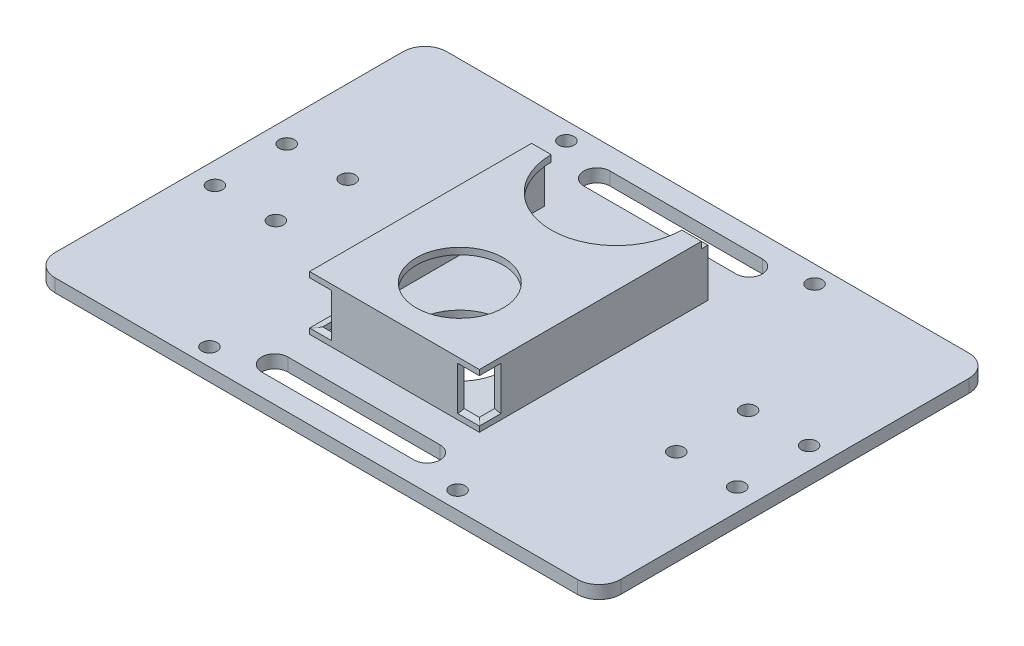
from build123d import *

# Parameters (mm, degrees)
SKETCH_1_R          = 1.75
EXTRUDE_1_DEPTH     = 3
EXTRUDE_2_DEPTH     = 11
EXTRUDE_3_DEPTH     = 1.5
SKETCH_5_R          = 10
CUT_EXTRUDE_1_DEPTH = 81.562087858
SKETCH_6_R          = 5
CUT_EXTRUDE_2_DEPTH = 5
SKETCH_7_R          = 5
CUT_EXTRUDE_3_DEPTH = 5
CUT_EXTRUDE_4_DEPTH = 3


with BuildPart() as part:
    # 草图1 → 凸台-拉伸1 (new body)
    with BuildSketch(Plane(origin=(0, 0, 0), x_dir=(1, 0, 0), z_dir=(0, 1, 0))):
        with BuildLine():
            Line((-60, 45), (60, 45))
            ThreePointArc((60, 45), (63.535533906, 43.535533906), (65, 40))
            Line((65, 40), (65, -40))
            ThreePointArc((65, -40), (63.535533906, -43.535533906), (60, -45))
            Line((60, -45), (-60, -45))
            ThreePointArc((-60, -45), (-63.535533906, -43.535533906), (-65, -40))
            Line((-65, -40), (-65, 40))
            ThreePointArc((-65, 40), (-63.535533906, 43.535533906), (-60, 45))
        make_face()
        with Locations(Location((-60, 8.25, 0), (0, 0, 270))):
            Circle(SKETCH_1_R, mode=Mode.SUBTRACT)
        with Locations(Location((-46, 8.25, 0), (0, 0, 270))):
            Circle(SKETCH_1_R, mode=Mode.SUBTRACT)
        with Locations(Location((-46, -8.25, 0), (0, 0, 90))):
            Circle(SKETCH_1_R, mode=Mode.SUBTRACT)
        with Locations(Location((-60, -8.25, 0), (0, 0, 90))):
            Circle(SKETCH_1_R, mode=Mode.SUBTRACT)
        with Locations(Location((60, 8.25, 0), (0, 0, 90))):
            Circle(SKETCH_1_R, mode=Mode.SUBTRACT)
        with Locations(Location((60, -8.25, 0), (0, 0, 270))):
            Circle(SKETCH_1_R, mode=Mode.SUBTRACT)
        with Locations(Location((46, -8.25, 0), (0, 0, 270))):
            Circle(SKETCH_1_R, mode=Mode.SUBTRACT)
        with Locations(Location((46, 8.25, 0), (0, 0, 90))):
            Circle(SKETCH_1_R, mode=Mode.SUBTRACT)
        with Locations(Location((-28.5, 41, 0), (0, 0, 270))):
            Circle(SKETCH_1_R, mode=Mode.SUBTRACT)
        with Locations(Location((-28.5, -41, 0), (0, 0, 90))):
            Circle(SKETCH_1_R, mode=Mode.SUBTRACT)
        with Locations(Location((28.5, -41, 0), (0, 0, 270))):
            Circle(SKETCH_1_R, mode=Mode.SUBTRACT)
        with Locations(Location((28.5, 41, 0), (0, 0, 90))):
            Circle(SKETCH_1_R, mode=Mode.SUBTRACT)
    extrude(amount=EXTRUDE_1_DEPTH)

    # 草图2 → 凸台-拉伸2 (add)
    with BuildSketch(Plane(origin=(0, 3, 0), x_dir=(1, 0, 0), z_dir=(0, 1, 0))):
        Polygon((18, 25.5), (19.5, 25.5), (19.5, -27), (-19.5, -27), (-19.5, 25.5), (-18, 25.5), (-18, -25.5), (18, -25.5), align=None)
    extrude(amount=EXTRUDE_2_DEPTH)

    # 草图3 → 凸台-拉伸3 (add)
    with BuildSketch(Plane(origin=(0, 14, 0), x_dir=(1, 0, 0), z_dir=(0, 1, 0))):
        with BuildLine():
            Line((-15, 24), (-18, 24))
            Line((-18, 24), (-18, -25.5))
            Line((-18, -25.5), (18, -25.5))
            Line((18, -25.5), (18, 24))
            Line((18, 24), (15, 24))
            ThreePointArc((15, 24), (0, 9), (-15, 24))
        make_face()
        Polygon((-18, 24), (-19.5, 24), (-19.5, -27), (19.5, -27), (19.5, 24), (18, 24), (18, -25.5), (-18, -25.5), align=None)
    extrude(amount=EXTRUDE_3_DEPTH)

    # 草图5 → 切除-拉伸1 (cut, through all)
    with BuildSketch(Plane(origin=(0, 15.5, 0), x_dir=(1, 0, 0), z_dir=(0, 1, 0))):
        with Locations(Location((0, -12, 0), (0, 0, 270))):
            Circle(SKETCH_5_R)
    extrude(amount=-CUT_EXTRUDE_1_DEPTH, mode=Mode.SUBTRACT)

    # 草图6 → 切除-拉伸2 (cut)
    with BuildSketch(Plane(origin=(19.5, 0, 0), x_dir=(0, 0, -1), z_dir=(1, 0, 0))):
        with Locations((-27, 9.25)):
            Circle(SKETCH_6_R)
    cut_extrude_2 = extrude(amount=-CUT_EXTRUDE_2_DEPTH, mode=Mode.SUBTRACT)

    # 草图7 → 切除-拉伸3 (cut)
    with BuildSketch(Plane.XY.offset(27)):
        with Locations((19.5, 9.25)):
            Circle(SKETCH_7_R)
    cut_extrude_3 = extrude(amount=-CUT_EXTRUDE_3_DEPTH, mode=Mode.SUBTRACT)

    # 镜向1: 切除-拉伸2, 切除-拉伸3 across plane
    add(cut_extrude_2.mirror(Plane(origin=(0, 0, 0), x_dir=(0, 0, 1), z_dir=(1, 0, 0))), mode=Mode.SUBTRACT)
    add(cut_extrude_3.mirror(Plane(origin=(0, 0, 0), x_dir=(0, 0, 1), z_dir=(1, 0, 0))), mode=Mode.SUBTRACT)

    # 草图8 → 切除-拉伸4 (cut)
    with BuildSketch(Plane(origin=(0, 3, 0), x_dir=(1, 0, 0), z_dir=(0, 1, 0))):
        with BuildLine():
            Line((-17.5, -34), (17.5, -34))
            ThreePointArc((17.5, -34), (20.5, -37), (17.5, -40))
            Line((17.5, -40), (-17.5, -40))
            ThreePointArc((-17.5, -40), (-20.5, -37), (-17.5, -34))
        make_face()
    cut_extrude_4 = extrude(amount=-CUT_EXTRUDE_4_DEPTH, mode=Mode.SUBTRACT)

    # 镜向2: 切除-拉伸4 across plane
    add(cut_extrude_4.mirror(Plane.XY), mode=Mode.SUBTRACT)


solid = part.part
